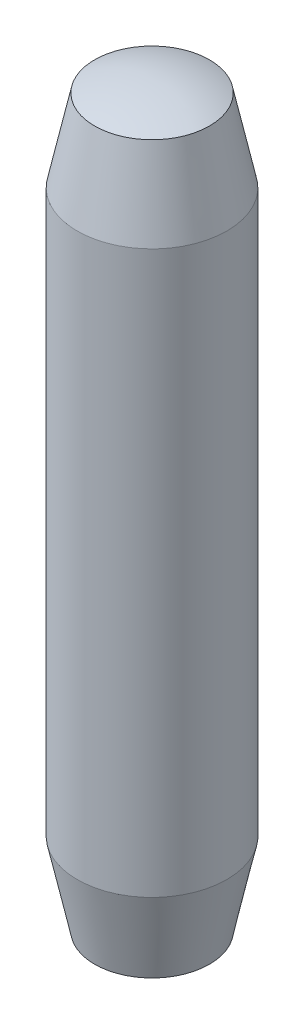
from build123d import *

# Parameters (mm, degrees)
SKETCH1_R           = 0.4
BOSS_EXTRUDE1_DEPTH = 4


with BuildPart() as part:
    # Sketch1 → Boss-Extrude1 (new body)
    with BuildSketch(Plane(origin=(0, 0, 0), x_dir=(1, 0, 0), z_dir=(0, 1, 0))):
        with Locations(Location((0, 0, 0), (0, 0, 270))):
            Circle(SKETCH1_R)
    extrude(amount=BOSS_EXTRUDE1_DEPTH)

    # Sketch2 → Cut-Revolve2 (revolve, cut)
    with BuildSketch(Plane.XY):
        with BuildLine():
            Line((0.4, 3.892820323), (0.4, 4.1))
            Line((0.4, 4.1), (0, 4.1))
            Line((0, 4.1), (0, 4))
            ThreePointArc((0, 4), (0.207055236, 3.972740661), (0.4, 3.892820323))
        make_face()
        with BuildLine():
            Line((0.4, -0.1), (0, -0.1))
            Line((0, -0.1), (0, 0))
            ThreePointArc((0, 0), (0.207055236, 0.027259339), (0.4, 0.107179677))
            Line((0.4, 0.107179677), (0.4, -0.1))
        make_face()
    revolve(axis=Axis((0, 0, 0), (0, 1, 0)), mode=Mode.SUBTRACT)

    # Sketch3 → Cut-Revolve3 (revolve, cut)
    with BuildSketch(Plane.XY, mode=Mode.PRIVATE) as cut_revolve3_sk:
        with BuildLine():
            Line((-0.4, 3.5), (-0.306715799, 3.93886766))
            ThreePointArc((-0.306715799, 3.93886766), (-0.354107179, 3.917361907), (-0.4, 3.892820323))
            Line((-0.4, 3.892820323), (-0.4, 3.5))
        make_face()
        with BuildLine():
            Line((-0.4, 0.107179677), (-0.4, 0.5))
            Line((-0.4, 0.5), (-0.306715799, 0.06113234))
            ThreePointArc((-0.306715799, 0.06113234), (-0.354107179, 0.082638093), (-0.4, 0.107179677))
        make_face()
    revolve(cut_revolve3_sk.sketch.rotate(Axis((0, 0, 0), (0, 1, 0)), 180), axis=Axis((0, 0, 0), (0, 1, 0)), mode=Mode.SUBTRACT)


solid = part.part
